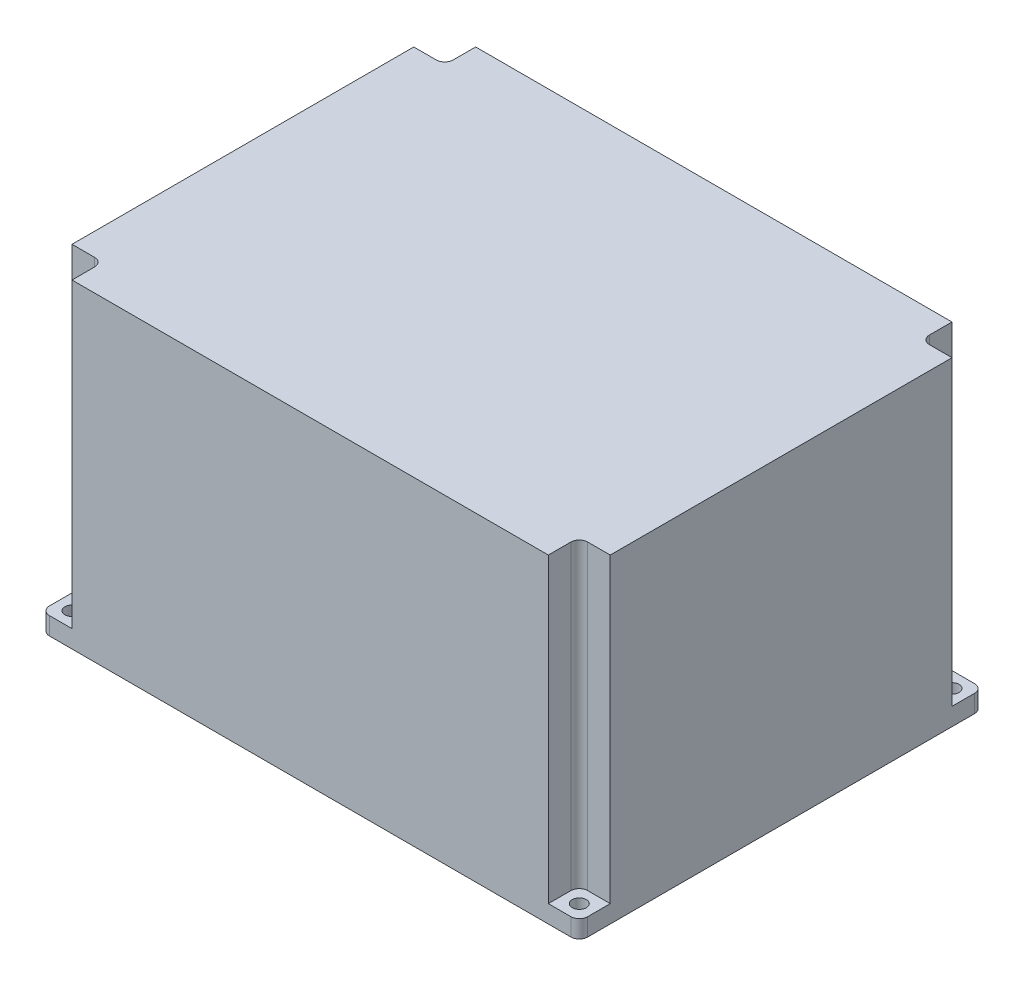
from build123d import *

# Parameters (mm, degrees)
DODANIE_WYCI_GNI_CIE1_DEPTH = 95
WYTNIJ_WYCI_GNI_CIE2_DEPTH  = 89.75
SZKIC6_R                    = 2.1
WYTNIJ_WYCI_GNI_CIE4_DEPTH  = 5.25
SZKIC7_W                    = 90
SZKIC7_H                    = 55.75
WYTNIJ_WYCI_GNI_CIE6_DEPTH  = 1


with BuildPart() as part:
    # Szkic1 → Dodanie-wyciągnięcie1 (new body)
    with BuildSketch(Plane(origin=(0, 0, 0), x_dir=(1, 0, 0), z_dir=(0, 1, 0))):
        with BuildLine():
            Line((-103.973988439, 70.578034682), (51.026011561, 70.578034682))
            ThreePointArc((51.026011561, 70.578034682), (52.793778514, 69.845801635), (53.526011561, 68.078034682))
            Line((53.526011561, 68.078034682), (53.526011561, -46.921965318))
            ThreePointArc((53.526011561, -46.921965318), (52.793778514, -48.689732271), (51.026011561, -49.421965318))
            Line((51.026011561, -49.421965318), (-103.973988439, -49.421965318))
            ThreePointArc((-103.973988439, -49.421965318), (-105.741755392, -48.689732271), (-106.473988439, -46.921965318))
            Line((-106.473988439, -46.921965318), (-106.473988439, 68.078034682))
            ThreePointArc((-106.473988439, 68.078034682), (-105.741755392, 69.845801635), (-103.973988439, 70.578034682))
        make_face()
    extrude(amount=DODANIE_WYCI_GNI_CIE1_DEPTH)

    # Szkic3 → Wytnij-wyciągnięcie2 (cut)
    with BuildSketch(Plane(origin=(0, 95, 0), x_dir=(1, 0, 0), z_dir=(0, 1, 0))):
        with BuildLine():
            Line((53.526011561, 70.578034682), (53.526011561, 61.378034682))
            Line((53.526011561, 61.378034682), (46.826011561, 61.378034682))
            ThreePointArc((46.826011561, 61.378034682), (45.058244608, 62.110267729), (44.326011561, 63.878034682))
            Line((44.326011561, 63.878034682), (44.326011561, 70.578034682))
            Line((44.326011561, 70.578034682), (53.526011561, 70.578034682))
        make_face()
        with BuildLine():
            Line((-97.273988439, 63.878034682), (-97.273988439, 70.578034682))
            Line((-97.273988439, 70.578034682), (-106.473988439, 70.578034682))
            Line((-106.473988439, 70.578034682), (-106.473988439, 61.378034682))
            Line((-106.473988439, 61.378034682), (-99.773988439, 61.378034682))
            ThreePointArc((-99.773988439, 61.378034682), (-98.006221486, 62.110267729), (-97.273988439, 63.878034682))
        make_face()
        with BuildLine():
            Line((-106.473988439, -49.421965318), (-106.473988439, -40.221965318))
            Line((-106.473988439, -40.221965318), (-99.773988439, -40.221965318))
            ThreePointArc((-99.773988439, -40.221965318), (-98.006221486, -40.954198365), (-97.273988439, -42.721965318))
            Line((-97.273988439, -42.721965318), (-97.273988439, -49.421965318))
            Line((-97.273988439, -49.421965318), (-106.473988439, -49.421965318))
        make_face()
        with BuildLine():
            Line((44.326011561, -42.721965318), (44.326011561, -49.421965318))
            Line((44.326011561, -49.421965318), (53.526011561, -49.421965318))
            Line((53.526011561, -49.421965318), (53.526011561, -40.221965318))
            Line((53.526011561, -40.221965318), (46.826011561, -40.221965318))
            ThreePointArc((46.826011561, -40.221965318), (45.058244608, -40.954198365), (44.326011561, -42.721965318))
        make_face()
    extrude(amount=-WYTNIJ_WYCI_GNI_CIE2_DEPTH, mode=Mode.SUBTRACT)

    # Szkic6 → Wytnij-wyciągnięcie4 (cut)
    with BuildSketch(Plane(origin=(0, 5.25, 0), x_dir=(1, 0, 0), z_dir=(0, 1, 0))):
        with Locations(Location((48.926011561, 65.978034682, 0), (0, 0, 270))):
            Circle(SZKIC6_R)
        with Locations(Location((-101.873988439, 65.978034682, 0), (0, 0, 270))):
            Circle(SZKIC6_R)
        with Locations(Location((-101.873988439, -44.821965318, 0), (0, 0, 270))):
            Circle(SZKIC6_R)
        with Locations(Location((48.926011561, -44.821965318, 0), (0, 0, 270))):
            Circle(SZKIC6_R)
    extrude(amount=-WYTNIJ_WYCI_GNI_CIE4_DEPTH, mode=Mode.SUBTRACT)

    # Szkic7 → Wytnij-wyciągnięcie6 (cut)
    with BuildSketch(Plane.ZY.offset(106.473988439)):
        with Locations((-10.578034682, 33.125)):
            Rectangle(SZKIC7_W, SZKIC7_H)
    extrude(amount=-WYTNIJ_WYCI_GNI_CIE6_DEPTH, mode=Mode.SUBTRACT)


solid = part.part
